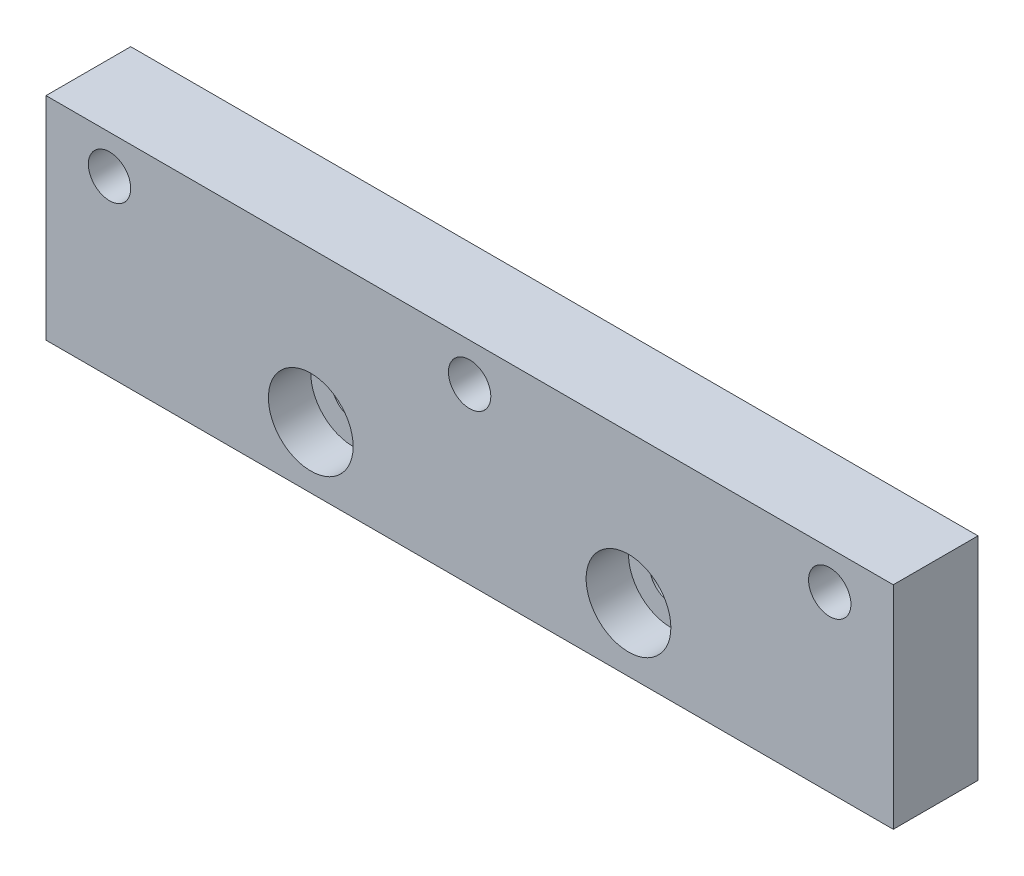
from build123d import *

# Parameters (mm, degrees)
SKETCH2_W           = 40
SKETCH2_H           = 10
BOSS_EXTRUDE1_DEPTH = 4
SKETCH3_R           = 1
CUT_EXTRUDE1_DEPTH  = 22
SKETCH4_R           = 2
CUT_EXTRUDE2_DEPTH  = 2


with BuildPart() as part:
    # Sketch2 → Boss-Extrude1 (new body)
    with BuildSketch(Plane.XY):
        Rectangle(SKETCH2_W, SKETCH2_H)
    extrude(amount=BOSS_EXTRUDE1_DEPTH)

    # Sketch3 → Cut-Extrude1 (cut, through all)
    with BuildSketch(Plane.XY.offset(4)):
        with Locations((-17, 3.2)):
            Circle(SKETCH3_R)
        with Locations((0, 3.2)):
            Circle(SKETCH3_R)
        with Locations((17, 3.2)):
            Circle(SKETCH3_R)
        with Locations((-7.5, -2)):
            Circle(SKETCH3_R)
        with Locations((7.5, -2)):
            Circle(SKETCH3_R)
    extrude(amount=-CUT_EXTRUDE1_DEPTH, mode=Mode.SUBTRACT)

    # Sketch4 → Cut-Extrude2 (cut)
    with BuildSketch(Plane.XY.offset(4)):
        with Locations((-7.5, -2.1)):
            Circle(SKETCH4_R)
        with Locations((7.5, -2)):
            Circle(SKETCH4_R)
    extrude(amount=-CUT_EXTRUDE2_DEPTH, mode=Mode.SUBTRACT)


solid = part.part
